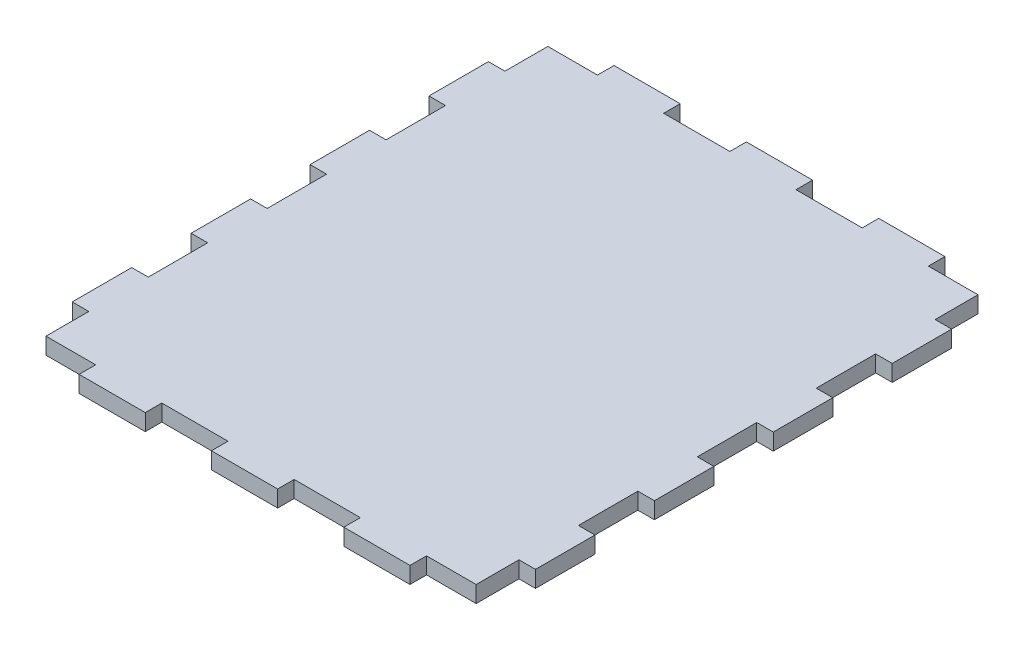
from build123d import *

# Parameters (mm, degrees)
ESBO_O1_W                = 84
ESBO_O1_H                = 97
RESSALTO_EXTRUS_O1_DEPTH = 3
ESBO_O2_W                = 3
ESBO_O2_H                = 10.777777778
CORTE_EXTRUS_O4_DEPTH    = 3
CORTE_EXTRUS_O9_REACH    = 66.228
ESBO_O5_W                = 12
ESBO_O5_H                = 3


with BuildPart() as part:
    # Esboço1 → Ressalto-extrusão1 (new body)
    with BuildSketch(Plane(origin=(0, 0, 0), x_dir=(1, 0, 0), z_dir=(0, 1, 0))):
        Rectangle(ESBO_O1_W, ESBO_O1_H)
    extrude(amount=RESSALTO_EXTRUS_O1_DEPTH)

    # Esboço2 → Corte-extrusão4 (cut)
    with BuildSketch(Plane.XZ):
        with Locations((-40.5, -43.111111111)):
            Rectangle(ESBO_O2_W, ESBO_O2_H)
        with Locations((40.5, -43.111111111)):
            Rectangle(ESBO_O2_W, ESBO_O2_H)
        with Locations((40.5, -21.551111111)):
            Rectangle(ESBO_O2_W, ESBO_O2_H)
        with Locations((40.5, 0.008888889)):
            Rectangle(ESBO_O2_W, ESBO_O2_H)
        with Locations((40.5, 21.568888889)):
            Rectangle(ESBO_O2_W, ESBO_O2_H)
        with Locations((40.5, 43.128888889)):
            Rectangle(ESBO_O2_W, ESBO_O2_H)
        with Locations((-40.5, -21.551111111)):
            Rectangle(ESBO_O2_W, ESBO_O2_H)
        with Locations((-40.5, 0.008888889)):
            Rectangle(ESBO_O2_W, ESBO_O2_H)
        with Locations((-40.5, 21.568888889)):
            Rectangle(ESBO_O2_W, ESBO_O2_H)
        with Locations((-40.5, 43.128888889)):
            Rectangle(ESBO_O2_W, ESBO_O2_H)
    extrude(amount=-CORTE_EXTRUS_O4_DEPTH, mode=Mode.SUBTRACT)

    # Esboço5 → Corte-extrusão9 (cut, up to next)
    with BuildSketch(Plane(origin=(0, 0, 0), x_dir=(1, 0, 0), z_dir=(0, 1, 0)), mode=Mode.PRIVATE) as corte_extrus_o9_sk1:
        with Locations((-36, 47)):
            Rectangle(ESBO_O5_W, ESBO_O5_H)
    corte_extrus_o9_tool1 = extrude(corte_extrus_o9_sk1.sketch, amount=CORTE_EXTRUS_O9_REACH, mode=Mode.PRIVATE) & part.part
    # Esboço5 → Corte-extrusão9 (cut, up to next)
    with BuildSketch(Plane(origin=(0, 0, 0), x_dir=(1, 0, 0), z_dir=(0, 1, 0)), mode=Mode.PRIVATE) as corte_extrus_o9_sk2:
        with Locations((-36, -47)):
            Rectangle(ESBO_O5_W, ESBO_O5_H)
    corte_extrus_o9_tool2 = extrude(corte_extrus_o9_sk2.sketch, amount=CORTE_EXTRUS_O9_REACH, mode=Mode.PRIVATE) & part.part
    # Esboço5 → Corte-extrusão9 (cut, up to next)
    with BuildSketch(Plane(origin=(0, 0, 0), x_dir=(1, 0, 0), z_dir=(0, 1, 0)), mode=Mode.PRIVATE) as corte_extrus_o9_sk3:
        with Locations((36, -47)):
            Rectangle(ESBO_O5_W, ESBO_O5_H)
    corte_extrus_o9_tool3 = extrude(corte_extrus_o9_sk3.sketch, amount=CORTE_EXTRUS_O9_REACH, mode=Mode.PRIVATE) & part.part
    # Esboço5 → Corte-extrusão9 (cut, up to next)
    with BuildSketch(Plane(origin=(0, 0, 0), x_dir=(1, 0, 0), z_dir=(0, 1, 0)), mode=Mode.PRIVATE) as corte_extrus_o9_sk4:
        with Locations((36, 47)):
            Rectangle(ESBO_O5_W, ESBO_O5_H)
    corte_extrus_o9_tool4 = extrude(corte_extrus_o9_sk4.sketch, amount=CORTE_EXTRUS_O9_REACH, mode=Mode.PRIVATE) & part.part
    # Esboço5 → Corte-extrusão9 (cut, up to next)
    with BuildSketch(Plane(origin=(0, 0, 0), x_dir=(1, 0, 0), z_dir=(0, 1, 0)), mode=Mode.PRIVATE) as corte_extrus_o9_sk5:
        with Locations((-12, -47)):
            Rectangle(ESBO_O5_W, ESBO_O5_H)
    corte_extrus_o9_tool5 = extrude(corte_extrus_o9_sk5.sketch, amount=CORTE_EXTRUS_O9_REACH, mode=Mode.PRIVATE) & part.part
    # Esboço5 → Corte-extrusão9 (cut, up to next)
    with BuildSketch(Plane(origin=(0, 0, 0), x_dir=(1, 0, 0), z_dir=(0, 1, 0)), mode=Mode.PRIVATE) as corte_extrus_o9_sk6:
        with Locations((12, -47)):
            Rectangle(ESBO_O5_W, ESBO_O5_H)
    corte_extrus_o9_tool6 = extrude(corte_extrus_o9_sk6.sketch, amount=CORTE_EXTRUS_O9_REACH, mode=Mode.PRIVATE) & part.part
    # Esboço5 → Corte-extrusão9 (cut, up to next)
    with BuildSketch(Plane(origin=(0, 0, 0), x_dir=(1, 0, 0), z_dir=(0, 1, 0)), mode=Mode.PRIVATE) as corte_extrus_o9_sk7:
        with Locations((-12, 47)):
            Rectangle(ESBO_O5_W, ESBO_O5_H)
    corte_extrus_o9_tool7 = extrude(corte_extrus_o9_sk7.sketch, amount=CORTE_EXTRUS_O9_REACH, mode=Mode.PRIVATE) & part.part
    # Esboço5 → Corte-extrusão9 (cut, up to next)
    with BuildSketch(Plane(origin=(0, 0, 0), x_dir=(1, 0, 0), z_dir=(0, 1, 0)), mode=Mode.PRIVATE) as corte_extrus_o9_sk8:
        with Locations((12, 47)):
            Rectangle(ESBO_O5_W, ESBO_O5_H)
    corte_extrus_o9_tool8 = extrude(corte_extrus_o9_sk8.sketch, amount=CORTE_EXTRUS_O9_REACH, mode=Mode.PRIVATE) & part.part
    add(corte_extrus_o9_tool1.solids().sort_by_distance((-36, 0, -47))[0], mode=Mode.SUBTRACT)
    add(corte_extrus_o9_tool2.solids().sort_by_distance((-36, 0, 47))[0], mode=Mode.SUBTRACT)
    add(corte_extrus_o9_tool3.solids().sort_by_distance((36, 0, 47))[0], mode=Mode.SUBTRACT)
    add(corte_extrus_o9_tool4.solids().sort_by_distance((36, 0, -47))[0], mode=Mode.SUBTRACT)
    add(corte_extrus_o9_tool5.solids().sort_by_distance((-12, 0, 47))[0], mode=Mode.SUBTRACT)
    add(corte_extrus_o9_tool6.solids().sort_by_distance((12, 0, 47))[0], mode=Mode.SUBTRACT)
    add(corte_extrus_o9_tool7.solids().sort_by_distance((-12, 0, -47))[0], mode=Mode.SUBTRACT)
    add(corte_extrus_o9_tool8.solids().sort_by_distance((12, 0, -47))[0], mode=Mode.SUBTRACT)


solid = part.part
